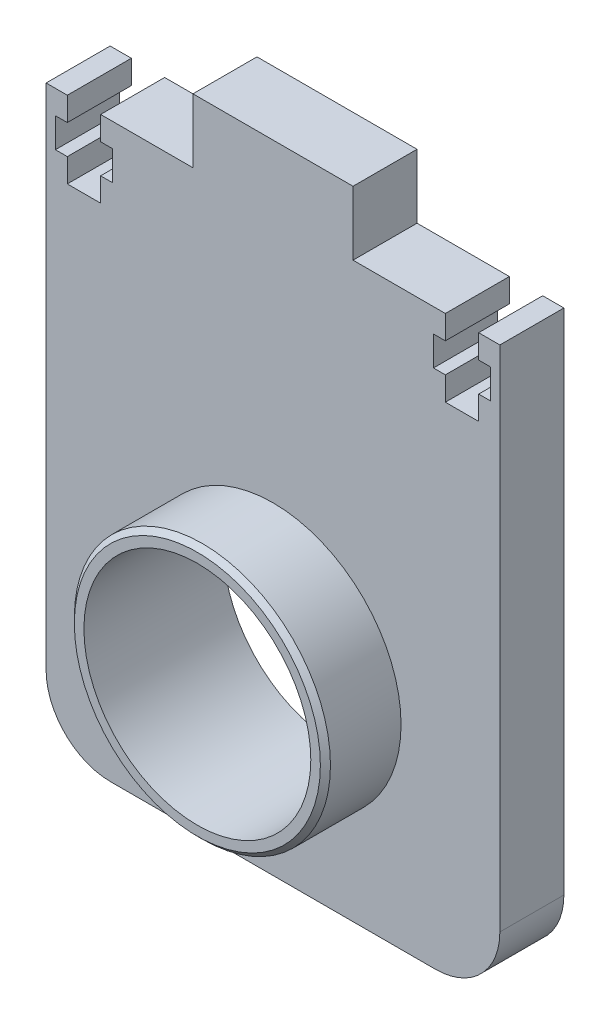
from build123d import *

# Parameters (mm, degrees)
SKETCH12_W           = 90
SKETCH12_H           = 126.33
BOSS_EXTRUDE10_DEPTH = 12.7
SKETCH15_R           = 25.4
BOSS_EXTRUDE11_DEPTH = 15
SKETCH23_R           = 22.5
CUT_EXTRUDE7_DEPTH   = 200.671813095
FILLET2_R            = 12.8
SKETCH25_W           = 29.125
SKETCH25_H           = 12.7
CUT_EXTRUDE9_DEPTH   = 199.309210439
CUT_EXTRUDE10_DEPTH  = 199.309210439
CHAMFER1_SIZE        = 1


with BuildPart() as part:
    # Sketch12 → Boss-Extrude10 (new body)
    with BuildSketch(Plane.XY):
        with Locations((107.125849364, 63.165)):
            Rectangle(SKETCH12_W, SKETCH12_H)
    extrude(amount=BOSS_EXTRUDE10_DEPTH)

    # Sketch15 → Boss-Extrude11 (add)
    with BuildSketch(Plane.XY.offset(12.7)):
        with Locations((107.125849364, 38.627603634)):
            Circle(SKETCH15_R)
    extrude(amount=BOSS_EXTRUDE11_DEPTH)

    # Sketch23 → Cut-Extrude7 (cut, through all)
    with BuildSketch(Plane.XY.offset(27.7)):
        with Locations((107.125849364, 38.627603634)):
            Circle(SKETCH23_R)
    extrude(amount=-CUT_EXTRUDE7_DEPTH, mode=Mode.SUBTRACT)

    # Fillet2
    fillet2_edges = [part.edges().sort_by_distance(p)[0] for p in [
        (152.125849364, 0, 6.35),
        (62.125849364, 0, 6.35),
    ]]
    fillet(fillet2_edges, radius=FILLET2_R)

    # Sketch25 → Cut-Extrude9 (cut, through all)
    with BuildSketch(Plane.XY.offset(12.7)):
        with Locations((137.563349364, 119.98)):
            Rectangle(SKETCH25_W, SKETCH25_H)
        with Locations((76.688349364, 119.98)):
            Rectangle(SKETCH25_W, SKETCH25_H)
    extrude(amount=-CUT_EXTRUDE9_DEPTH, mode=Mode.SUBTRACT)

    # Sketch27 → Cut-Extrude10 (cut, through all)
    with BuildSketch(Plane.XY.offset(12.7)):
        Polygon((147.917849364, 113.63), (147.917849364, 108.931), (150.279849364, 108.931), (150.279849364, 103.089), (147.917849364, 103.089), (147.917849364, 98.39), (141.313849364, 98.39), (141.313849364, 103.089), (138.951849364, 103.089), (138.951849364, 108.931), (141.313849364, 108.931), (141.313849364, 113.63), align=None)
        Polygon((72.937849364, 103.089), (75.299849364, 103.089), (75.299849364, 108.931), (72.937849364, 108.931), (72.937849364, 113.63), (66.333849364, 113.63), (66.333849364, 108.931), (63.971849364, 108.931), (63.971849364, 103.089), (66.333849364, 103.089), (66.333849364, 98.39), (72.937849364, 98.39), align=None)
    extrude(amount=-CUT_EXTRUDE10_DEPTH, mode=Mode.SUBTRACT)

    # Chamfer1
    chamfer1_edges = [part.edges().sort_by_distance(p)[0] for p in [
        (81.725849364, 38.627603634, 27.7),
    ]]
    chamfer(chamfer1_edges, length=CHAMFER1_SIZE)


solid = part.part
